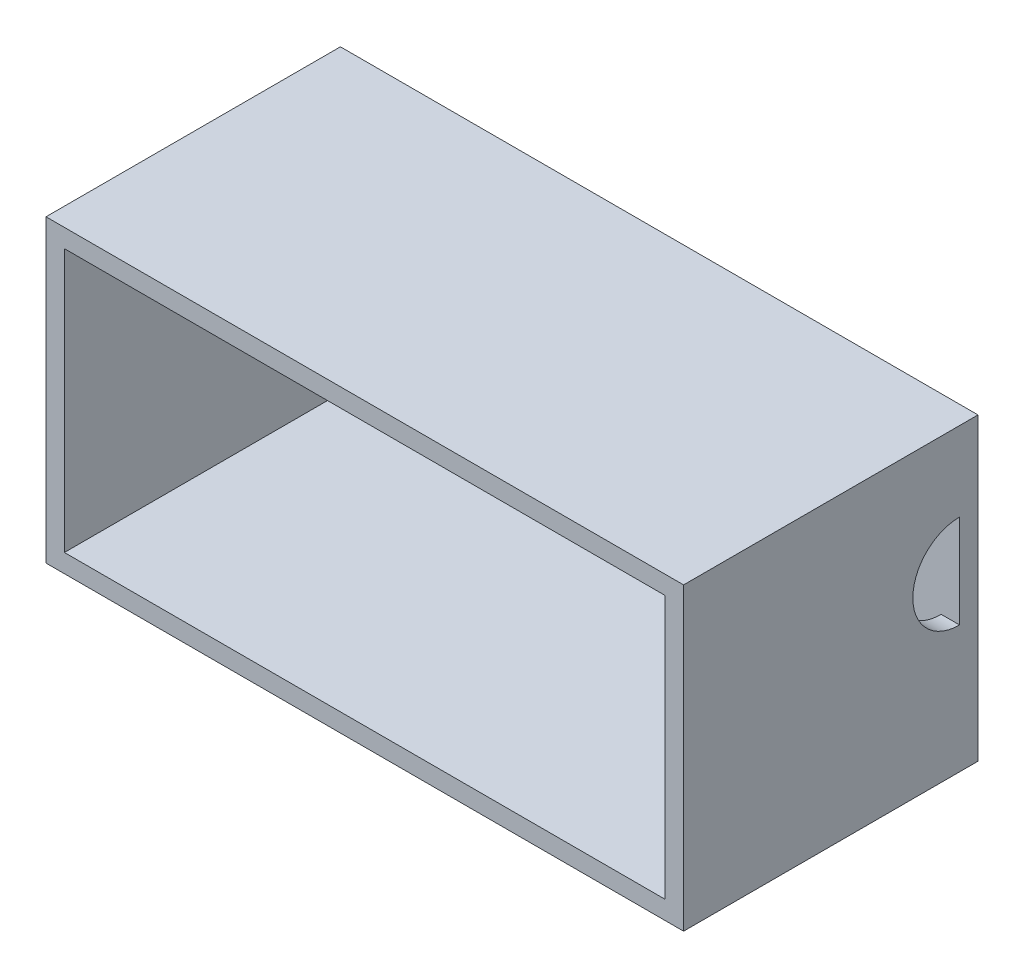
from build123d import *

# Parameters (mm, degrees)
ESQUISSE1_W             = 69.3
ESQUISSE1_H             = 32.6
ESQUISSE1_W_2           = 65.3
ESQUISSE1_H_2           = 28.6
BOSS_EXTRU_1_DEPTH      = 30
ESQUISSE3_W             = 69.3
ESQUISSE3_H             = 32.6
BOSS_EXTRU_2_DEPTH      = 2
ESQUISSE4_W             = 4
ESQUISSE4_H             = 13
ENL_V_MAT_EXTRU_1_DEPTH = 18
ENL_V_MAT_EXTRU_2_DEPTH = 18


with BuildPart() as part:
    # Esquisse1 → Boss.-Extru.1 (new body)
    with BuildSketch(Plane.XY):
        with Locations((8.234452659, -4.576404494)):
            Rectangle(ESQUISSE1_W, ESQUISSE1_H)
        with Locations((8.234452659, -4.576404494)):
            Rectangle(ESQUISSE1_W_2, ESQUISSE1_H_2, mode=Mode.SUBTRACT)
    extrude(amount=BOSS_EXTRU_1_DEPTH)

    # Esquisse3 → Boss.-Extru.2 (add)
    with BuildSketch(Plane(origin=(0, 0, 0), x_dir=(-1, 0, 0), z_dir=(0, 0, -1))):
        with Locations((-8.234452659, -4.576404494)):
            Rectangle(ESQUISSE3_W, ESQUISSE3_H)
    extrude(amount=BOSS_EXTRU_2_DEPTH)

    # Esquisse4 → Enlèv. mat.-Extru.1 (cut)
    with BuildSketch(Plane(origin=(-24.415547341, 0, 0), x_dir=(0, 0, -1), z_dir=(1, 0, 0))):
        with Locations((-2, -6.776404494)):
            Rectangle(ESQUISSE4_W, ESQUISSE4_H)
    extrude(amount=-ENL_V_MAT_EXTRU_1_DEPTH, mode=Mode.SUBTRACT)

    # Esquisse5 → Enlèv. mat.-Extru.2 (cut)
    with BuildSketch(Plane.ZY.offset(-40.884452659)):
        with BuildLine():
            Line((0, 3.111294122), (0, -7.052256907))
            ThreePointArc((0, -7.052256907), (5.081775514, -1.970481392), (0, 3.111294122))
        make_face()
    extrude(amount=-ENL_V_MAT_EXTRU_2_DEPTH, mode=Mode.SUBTRACT)


solid = part.part
